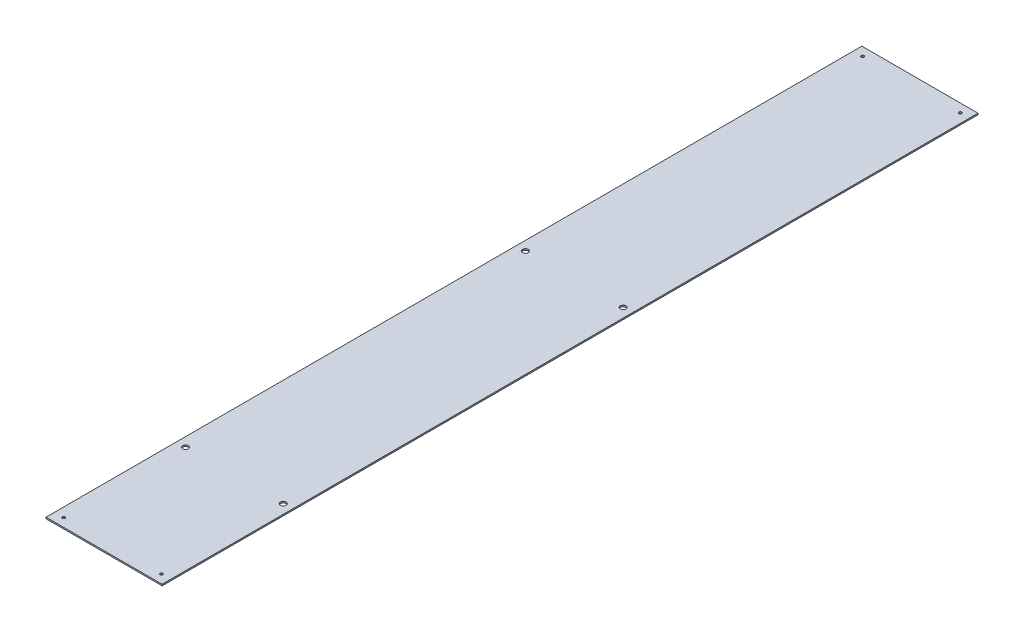
from build123d import *

# Parameters (mm, degrees)
SKETCH1_W           = 130.175
SKETCH1_H           = 914.4
BOSS_EXTRUDE1_DEPTH = 1.5875
SKETCH2_R           = 1.5875
SKETCH2_R_2         = 3.175
CUT_EXTRUDE2_DEPTH  = 462.812454155


with BuildPart() as part:
    # Sketch1 → Boss-Extrude1 (new body)
    with BuildSketch(Plane(origin=(0, 0, 0), x_dir=(1, 0, 0), z_dir=(0, 1, 0))):
        Rectangle(SKETCH1_W, SKETCH1_H)
    extrude(amount=-BOSS_EXTRUDE1_DEPTH)

    # Sketch2 → Cut-Extrude2 (cut, through all)
    with BuildSketch(Plane(origin=(0, 0, 0), x_dir=(1, 0, 0), z_dir=(0, 1, 0))):
        with Locations(Location((54.76875, -447.675, 0), (0, 0, 270))):
            Circle(SKETCH2_R)
        with Locations(Location((54.76875, -311.15, 0), (0, 0, 270))):
            Circle(SKETCH2_R_2)
        with Locations(Location((54.76875, 447.675, 0), (0, 0, 270))):
            Circle(SKETCH2_R)
        with Locations(Location((54.76875, 69.85, 0), (0, 0, 270))):
            Circle(SKETCH2_R_2)
    cut_extrude2 = extrude(amount=-CUT_EXTRUDE2_DEPTH, mode=Mode.SUBTRACT)

    # Mirror2: Cut-Extrude2 across plane
    add(cut_extrude2.mirror(Plane(origin=(0, 0, 0), x_dir=(0, 0, 1), z_dir=(1, 0, 0))), mode=Mode.SUBTRACT)


solid = part.part
